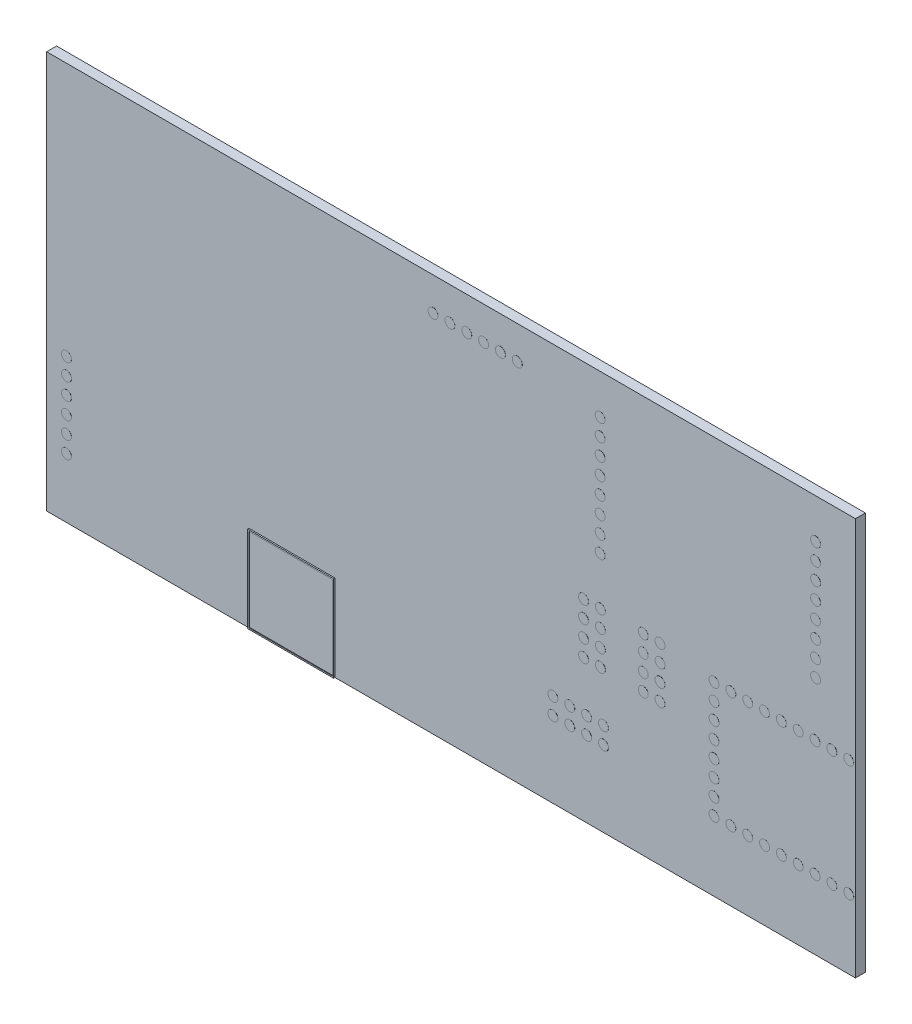
from build123d import *

# Parameters (mm, degrees)
SKETCH1_W           = 122
SKETCH1_H           = 60
BOSS_EXTRUDE1_DEPTH = 1.5
SKETCH2_R           = 0.75
BOSS_EXTRUDE2_DEPTH = 0.01
SKETCH3_W           = 13
SKETCH3_H           = 13
BOSS_EXTRUDE3_DEPTH = 0.1
SKETCH4_W           = 13
SKETCH4_H           = 13
SKETCH4_W_2         = 12.6
SKETCH4_H_2         = 12.6
BOSS_EXTRUDE4_DEPTH = 0.1


with BuildPart() as part:
    # Sketch1 → Boss-Extrude1 (new body)
    with BuildSketch(Plane.XY):
        Rectangle(SKETCH1_W, SKETCH1_H)
    extrude(amount=BOSS_EXTRUDE1_DEPTH)

    # Sketch2 → Boss-Extrude2 (add)
    with BuildSketch(Plane.XY.offset(1.5)):
        with Locations(Location((60, -2, 0), (0, 0, 180))):
            Circle(SKETCH2_R)
        with Locations(Location((57.46, -2, 0), (0, 0, 180))):
            Circle(SKETCH2_R)
        with Locations(Location((54.92, -2, 0), (0, 0, 180))):
            Circle(SKETCH2_R)
        with Locations(Location((52.38, -2, 0), (0, 0, 180))):
            Circle(SKETCH2_R)
        with Locations(Location((49.84, -2, 0), (0, 0, 180))):
            Circle(SKETCH2_R)
        with Locations(Location((47.3, -2, 0), (0, 0, 180))):
            Circle(SKETCH2_R)
        with Locations(Location((44.76, -2, 0), (0, 0, 180))):
            Circle(SKETCH2_R)
        with Locations(Location((42.22, -2, 0), (0, 0, 180))):
            Circle(SKETCH2_R)
        with Locations(Location((57.46, -19.5, 0), (0, 0, 180))):
            Circle(SKETCH2_R)
        with Locations(Location((54.92, -19.5, 0), (0, 0, 180))):
            Circle(SKETCH2_R)
        with Locations(Location((52.38, -19.5, 0), (0, 0, 180))):
            Circle(SKETCH2_R)
        with Locations(Location((49.84, -19.5, 0), (0, 0, 180))):
            Circle(SKETCH2_R)
        with Locations(Location((47.3, -19.5, 0), (0, 0, 180))):
            Circle(SKETCH2_R)
        with Locations(Location((44.76, -19.5, 0), (0, 0, 180))):
            Circle(SKETCH2_R)
        with Locations(Location((42.22, -19.5, 0), (0, 0, 180))):
            Circle(SKETCH2_R)
        with Locations(Location((60, -19.5, 0), (0, 0, 180))):
            Circle(SKETCH2_R)
        with Locations(Location((39.68, -2, 0), (0, 0, 180))):
            Circle(SKETCH2_R)
        with Locations(Location((39.68, -4.5, 0), (0, 0, 180))):
            Circle(SKETCH2_R)
        with Locations(Location((39.68, -7, 0), (0, 0, 180))):
            Circle(SKETCH2_R)
        with Locations(Location((39.68, -9.5, 0), (0, 0, 180))):
            Circle(SKETCH2_R)
        with Locations(Location((39.68, -12, 0), (0, 0, 180))):
            Circle(SKETCH2_R)
        with Locations(Location((39.68, -14.5, 0), (0, 0, 180))):
            Circle(SKETCH2_R)
        with Locations(Location((39.68, -17, 0), (0, 0, 180))):
            Circle(SKETCH2_R)
        with Locations(Location((39.68, -19.5, 0), (0, 0, 180))):
            Circle(SKETCH2_R)
        with Locations(Location((55, 24, 0), (0, 0, 180))):
            Circle(SKETCH2_R)
        with Locations(Location((22.5, 24, 0), (0, 0, 180))):
            Circle(SKETCH2_R)
        with Locations(Location((22.5, 21.46, 0), (0, 0, 180))):
            Circle(SKETCH2_R)
        with Locations(Location((22.5, 18.92, 0), (0, 0, 180))):
            Circle(SKETCH2_R)
        with Locations(Location((22.5, 16.38, 0), (0, 0, 180))):
            Circle(SKETCH2_R)
        with Locations(Location((22.5, 13.84, 0), (0, 0, 180))):
            Circle(SKETCH2_R)
        with Locations(Location((22.5, 11.3, 0), (0, 0, 180))):
            Circle(SKETCH2_R)
        with Locations(Location((22.5, 8.76, 0), (0, 0, 180))):
            Circle(SKETCH2_R)
        with Locations(Location((22.5, 6.22, 0), (0, 0, 180))):
            Circle(SKETCH2_R)
        with Locations(Location((55, 21.46, 0), (0, 0, 180))):
            Circle(SKETCH2_R)
        with Locations(Location((55, 18.92, 0), (0, 0, 180))):
            Circle(SKETCH2_R)
        with Locations(Location((55, 16.38, 0), (0, 0, 180))):
            Circle(SKETCH2_R)
        with Locations(Location((55, 13.84, 0), (0, 0, 180))):
            Circle(SKETCH2_R)
        with Locations(Location((55, 11.3, 0), (0, 0, 180))):
            Circle(SKETCH2_R)
        with Locations(Location((55, 8.76, 0), (0, 0, 180))):
            Circle(SKETCH2_R)
        with Locations(Location((55, 6.22, 0), (0, 0, 180))):
            Circle(SKETCH2_R)
        with Locations(Location((10, 25, 0), (0, 0, 180))):
            Circle(SKETCH2_R)
        with Locations(Location((7.46, 25, 0), (0, 0, 180))):
            Circle(SKETCH2_R)
        with Locations(Location((4.92, 25, 0), (0, 0, 180))):
            Circle(SKETCH2_R)
        with Locations(Location((2.38, 25, 0), (0, 0, 180))):
            Circle(SKETCH2_R)
        with Locations(Location((-0.16, 25, 0), (0, 0, 180))):
            Circle(SKETCH2_R)
        with Locations(Location((-2.7, 25, 0), (0, 0, 180))):
            Circle(SKETCH2_R)
        with Locations(Location((-58, -21, 0), (0, 0, 180))):
            Circle(SKETCH2_R)
        with Locations(Location((-58, -18.46, 0), (0, 0, 180))):
            Circle(SKETCH2_R)
        with Locations(Location((-58, -15.92, 0), (0, 0, 180))):
            Circle(SKETCH2_R)
        with Locations(Location((-58, -13.38, 0), (0, 0, 180))):
            Circle(SKETCH2_R)
        with Locations(Location((-58, -10.84, 0), (0, 0, 180))):
            Circle(SKETCH2_R)
        with Locations(Location((-58, -8.3, 0), (0, 0, 180))):
            Circle(SKETCH2_R)
        with Locations(Location((20, -1, 0), (0, 0, 180))):
            Circle(SKETCH2_R)
        with Locations(Location((22.54, -1, 0), (0, 0, 180))):
            Circle(SKETCH2_R)
        with Locations(Location((22.54, -3.54, 0), (0, 0, 180))):
            Circle(SKETCH2_R)
        with Locations(Location((22.54, -6.08, 0), (0, 0, 180))):
            Circle(SKETCH2_R)
        with Locations(Location((22.54, -8.62, 0), (0, 0, 180))):
            Circle(SKETCH2_R)
        with Locations(Location((20, -3.54, 0), (0, 0, 180))):
            Circle(SKETCH2_R)
        with Locations(Location((20, -6.08, 0), (0, 0, 180))):
            Circle(SKETCH2_R)
        with Locations(Location((20, -8.62, 0), (0, 0, 180))):
            Circle(SKETCH2_R)
        with Locations(Location((29, -1, 0), (0, 0, 180))):
            Circle(SKETCH2_R)
        with Locations(Location((31.54, -1, 0), (0, 0, 180))):
            Circle(SKETCH2_R)
        with Locations(Location((31.54, -3.54, 0), (0, 0, 180))):
            Circle(SKETCH2_R)
        with Locations(Location((29, -3.54, 0), (0, 0, 180))):
            Circle(SKETCH2_R)
        with Locations(Location((29, -6.08, 0), (0, 0, 180))):
            Circle(SKETCH2_R)
        with Locations(Location((29, -8.62, 0), (0, 0, 180))):
            Circle(SKETCH2_R)
        with Locations(Location((31.54, -8.62, 0), (0, 0, 180))):
            Circle(SKETCH2_R)
        with Locations(Location((31.54, -6.08, 0), (0, 0, 180))):
            Circle(SKETCH2_R)
        with Locations(Location((23, -16, 0), (0, 0, 180))):
            Circle(SKETCH2_R)
        with Locations(Location((20.46, -16, 0), (0, 0, 180))):
            Circle(SKETCH2_R)
        with Locations(Location((17.92, -16, 0), (0, 0, 180))):
            Circle(SKETCH2_R)
        with Locations(Location((15.38, -16, 0), (0, 0, 180))):
            Circle(SKETCH2_R)
        with Locations(Location((20.46, -18.54, 0), (0, 0, 180))):
            Circle(SKETCH2_R)
        with Locations(Location((17.92, -18.54, 0), (0, 0, 180))):
            Circle(SKETCH2_R)
        with Locations(Location((15.38, -18.54, 0), (0, 0, 180))):
            Circle(SKETCH2_R)
        with Locations(Location((23, -18.54, 0), (0, 0, 180))):
            Circle(SKETCH2_R)
    extrude(amount=BOSS_EXTRUDE2_DEPTH)

    # Sketch3 → Boss-Extrude3 (add)
    with BuildSketch(Plane.XY.offset(1.5)):
        with Locations((-24, -23.5)):
            Rectangle(SKETCH3_W, SKETCH3_H)
    extrude(amount=BOSS_EXTRUDE3_DEPTH)

    # Sketch4 → Boss-Extrude4 (add)
    with BuildSketch(Plane.XY.offset(1.6)):
        with Locations((-24, -23.5)):
            Rectangle(SKETCH4_W, SKETCH4_H)
        with Locations((-24, -23.5)):
            Rectangle(SKETCH4_W_2, SKETCH4_H_2, mode=Mode.SUBTRACT)
    extrude(amount=BOSS_EXTRUDE4_DEPTH)


solid = part.part
